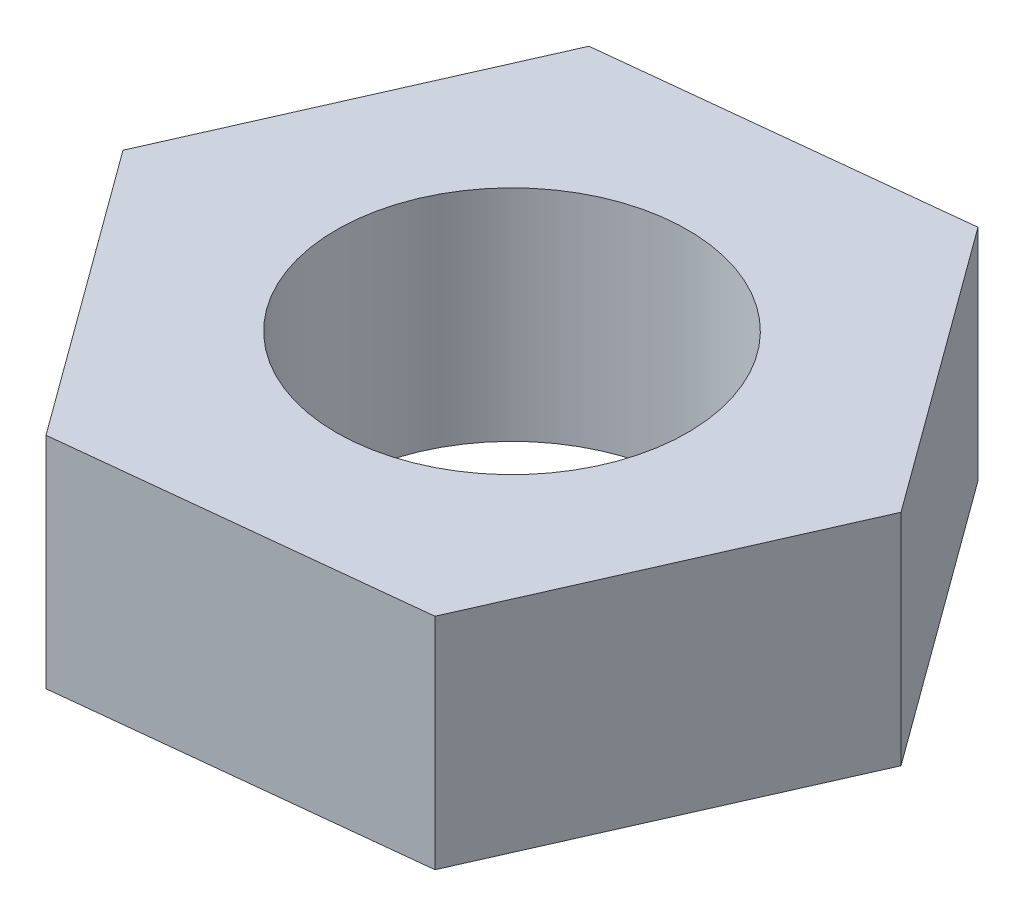
from build123d import *

# Parameters (mm, degrees)
SKETCH1_R           = 4
BOSS_EXTRUDE1_DEPTH = 5


with BuildPart() as part:
    # Sketch1 → Boss-Extrude1 (new body)
    with BuildSketch(Plane(origin=(0, 0, 0), x_dir=(1, 0, 0), z_dir=(0, 1, 0))):
        Polygon((4.744430624, -6.497608589), (7.999309414, 0.859993152), (3.25487879, 7.357601742), (-4.744430624, 6.497608589), (-7.999309414, -0.859993152), (-3.25487879, -7.357601742), align=None)
        with Locations(Location((0, 0, 0), (0, 0, 270))):
            Circle(SKETCH1_R, mode=Mode.SUBTRACT)
    extrude(amount=BOSS_EXTRUDE1_DEPTH)


solid = part.part
